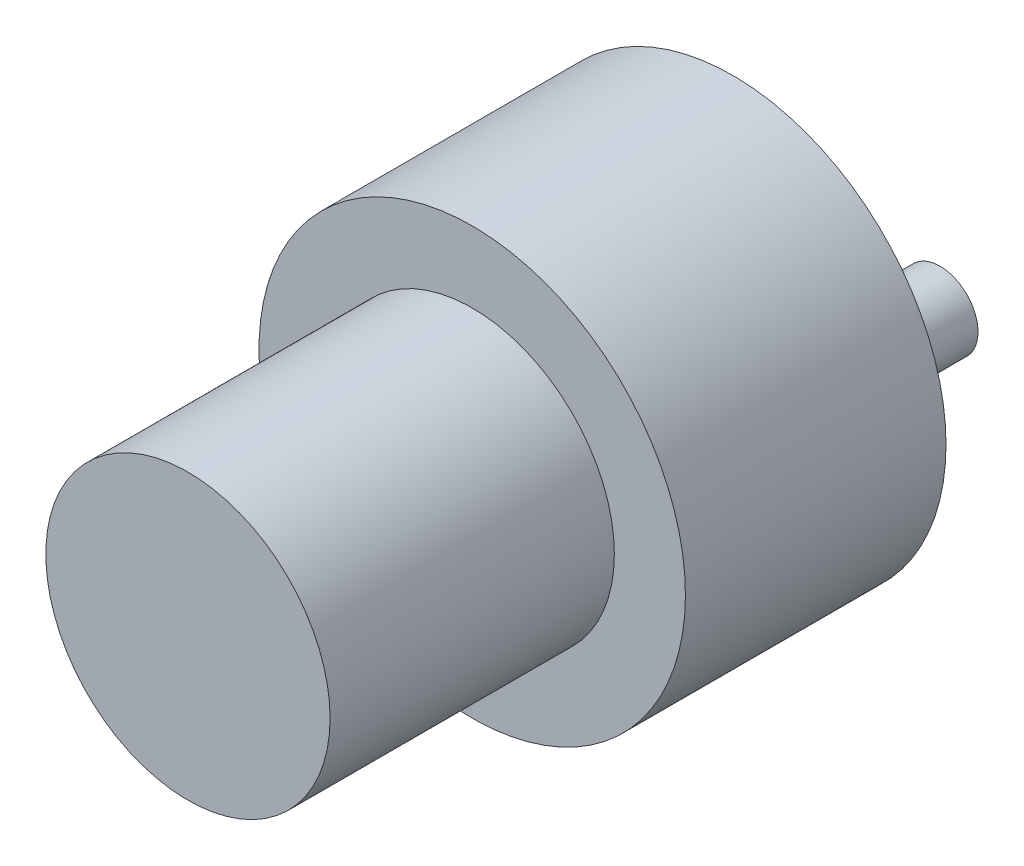
from build123d import *

# Parameters (mm, degrees)
SKETCH1_R           = 22.5
BOSS_EXTRUDE1_DEPTH = 27.5
SKETCH2_R           = 15
BOSS_EXTRUDE2_DEPTH = 30
SKETCH3_R           = 4
BOSS_EXTRUDE3_DEPTH = 12


with BuildPart() as part:
    # Sketch1 → Boss-Extrude1 (new body)
    with BuildSketch(Plane.XY):
        Circle(SKETCH1_R)
    extrude(amount=BOSS_EXTRUDE1_DEPTH)

    # Sketch3 → Boss-Extrude3 (add)
    with BuildSketch(Plane(origin=(0, 0, 0), x_dir=(-1, 0, 0), z_dir=(0, 0, -1))):
        with Locations(Location((-9.875839743, 0, 0), (0, 0, 180))):
            Circle(SKETCH3_R)
    extrude(amount=BOSS_EXTRUDE3_DEPTH)


with BuildPart() as body_2:
    # Sketch2 → Boss-Extrude2 (new body)
    with BuildSketch(Plane.XY.offset(27.5)):
        Circle(SKETCH2_R)
    extrude(amount=BOSS_EXTRUDE2_DEPTH)


solid = Compound([part.part, body_2.part])
